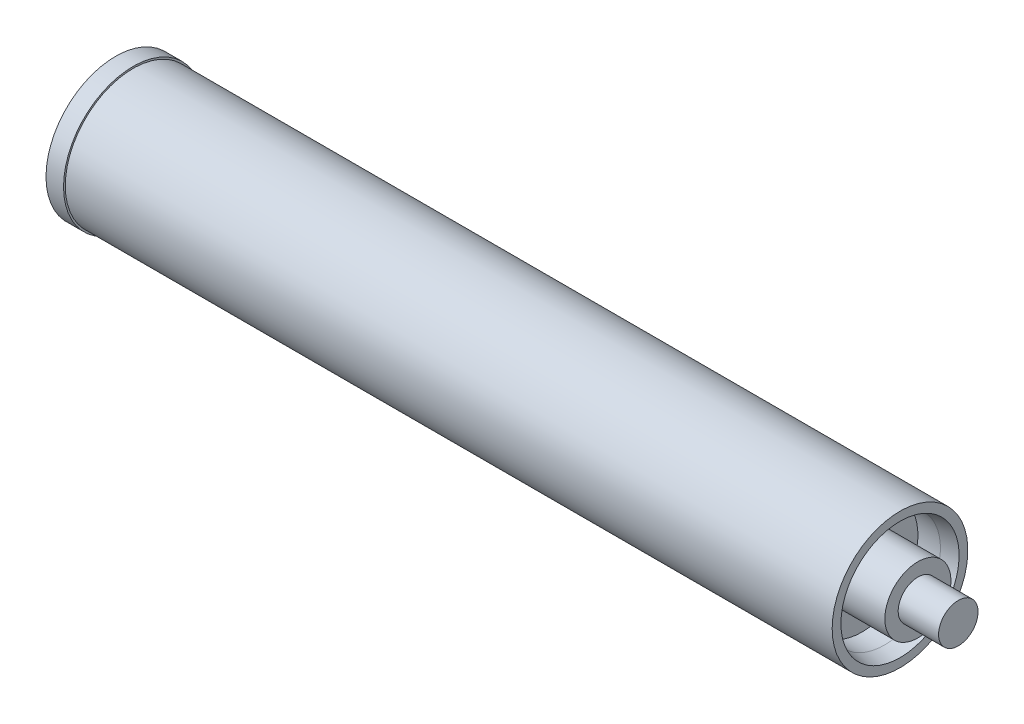
from build123d import *


with BuildPart() as part:
    # Esquisse2 → Révolution7 (revolve)
    with BuildSketch(Plane.XY, mode=Mode.PRIVATE) as r_volution7_sk:
        Polygon((0, 26), (12.7, 26), (36.56741584, 26), (36.56741584, 35.689138439), (25.4, 35.689138439), (12.7, 38.2095), (12.7, 50.419), (25.4, 50.419), (25.4, 49.149), (581.02, 49.149), (581.02, 42.820187711), (569.69714835, 40.573126289), (553.411969834, 40.573126289), (553.411969834, 23.9395), (593.98, 23.9395), (593.98, 14.2875), (623.27, 14.2875), (623.27, 0), (0, 0), align=None)
    revolve(r_volution7_sk.sketch.rotate(Axis((0, 0, 0), (1, 0, 0)), 90), axis=Axis((0, 0, 0), (1, 0, 0)))

    # Esquisse3 → Enlèvement de matière-Révolution1 (revolve, cut)
    with BuildSketch(Plane.XY, mode=Mode.PRIVATE) as enl_vement_de_mati_re_r_volution1_sk:
        Polygon((0, 20), (0, 0), (390.090795287, 0), (553.411969834, 12.957757221), (381.061065959, 12.957757221), (381.061065959, 44.271024873), (65.871878934, 44.271024873), (34.08300614, 14.327580407), (19.08300614, 14.327580407), align=None)
    revolve(enl_vement_de_mati_re_r_volution1_sk.sketch.rotate(Axis((0, 0, 0), (1, 0, 0)), 90), axis=Axis((0, 0, 0), (1, 0, 0)), mode=Mode.SUBTRACT)


solid = part.part
